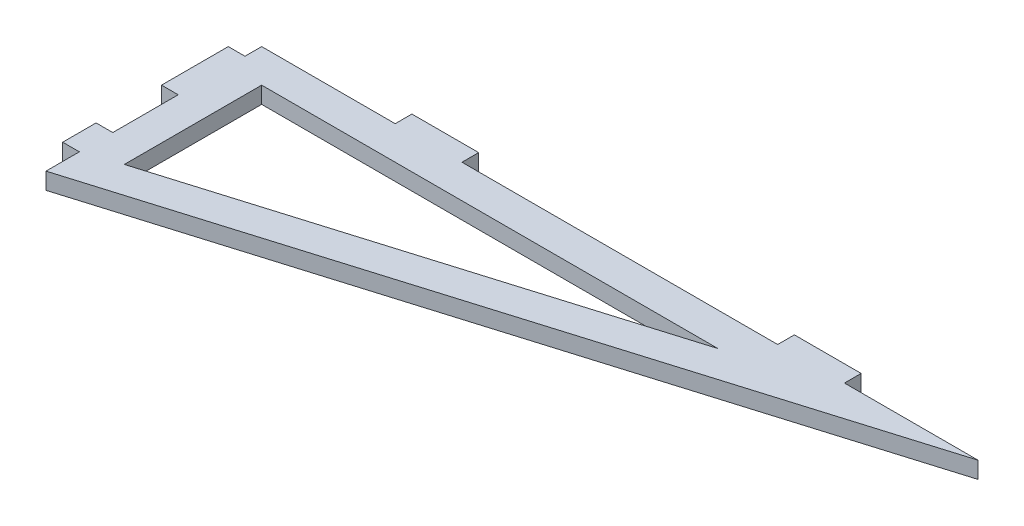
from build123d import *

# Parameters (mm, degrees)
BOSS_EXTRUDE1_DEPTH = 3.175


with BuildPart() as part:
    # Sketch1 → Boss-Extrude1 (new body)
    with BuildSketch(Plane(origin=(0, 0, 0), x_dir=(1, 0, 0), z_dir=(0, 1, 0))):
        Polygon((68.1228, 20.51), (42.7228, 20.51), (42.7228, 23.685), (30.0228, 23.685), (30.0228, 20.51), (-30.0228, 20.51), (-30.0228, 23.685), (-42.7228, 23.685), (-42.7228, 20.51), (-68.1228, 20.51), (-68.1228, 17.335), (-71.2978, 17.335), (-71.2978, 4.635), (-68.1228, 4.635), (-68.1228, -7.81), (-71.2978, -7.81), (-71.2978, -14.16), (-68.1228, -14.16), (-68.1228, -20.51), align=None)
        Polygon((-61.7728, 14.16), (-61.7728, -11.966623033), (25.00529437, 14.16), align=None, mode=Mode.SUBTRACT)
    extrude(amount=BOSS_EXTRUDE1_DEPTH)


solid = part.part
